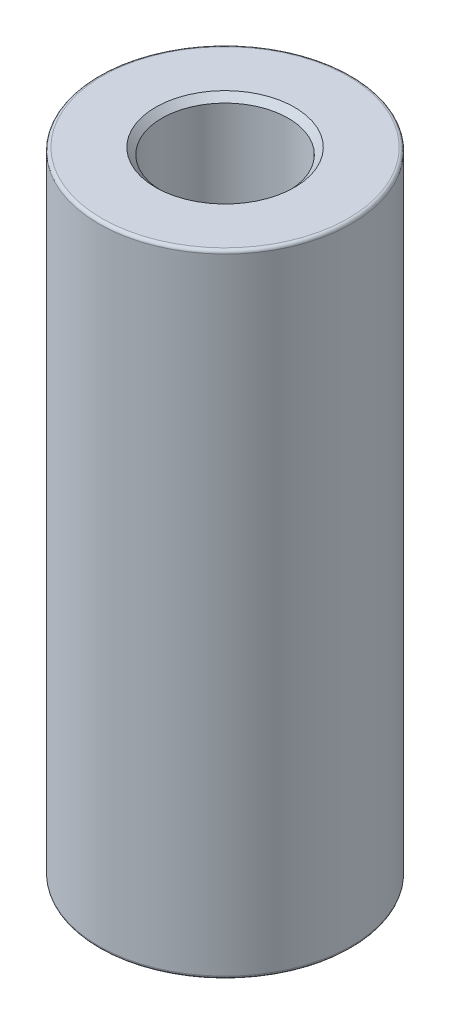
from build123d import *

# Parameters (mm, degrees)
SKETCH_1_R          = 40
EXTRUDE_1_DEPTH     = 200
SKETCH_2_R          = 20
CUT_EXTRUDE_1_DEPTH = 150
CHAMFER_1_SIZE      = 2
FILLET_1_R          = 1
FILLET_2_R          = 1


with BuildPart() as part:
    # Эскиз1 → Бобышка-Вытянуть1 (new body)
    with BuildSketch(Plane(origin=(0, 0, 0), x_dir=(1, 0, 0), z_dir=(0, 1, 0))):
        with Locations(Location((0, 0, 0), (0, 0, 270))):
            Circle(SKETCH_1_R)
    extrude(amount=EXTRUDE_1_DEPTH)

    # Эскиз2 → Вырез-Вытянуть1 (cut)
    with BuildSketch(Plane(origin=(0, 200, 0), x_dir=(1, 0, 0), z_dir=(0, 1, 0))):
        with Locations(Location((0, 0, 0), (0, 0, 270))):
            Circle(SKETCH_2_R)
    extrude(amount=-CUT_EXTRUDE_1_DEPTH, mode=Mode.SUBTRACT)

    # Фаска1
    chamfer_1_edges = [part.edges().sort_by_distance(p)[0] for p in [
        (0, 200, -20),
    ]]
    chamfer(chamfer_1_edges, length=CHAMFER_1_SIZE)

    # Скругление1
    fillet_1_edges = [part.edges().sort_by_distance(p)[0] for p in [
        (0, 0, -40),
    ]]
    fillet(fillet_1_edges, radius=FILLET_1_R)

    # Скругление2
    fillet_2_edges = [part.edges().sort_by_distance(p)[0] for p in [
        (0, 200, -40),
    ]]
    fillet(fillet_2_edges, radius=FILLET_2_R)


solid = part.part
